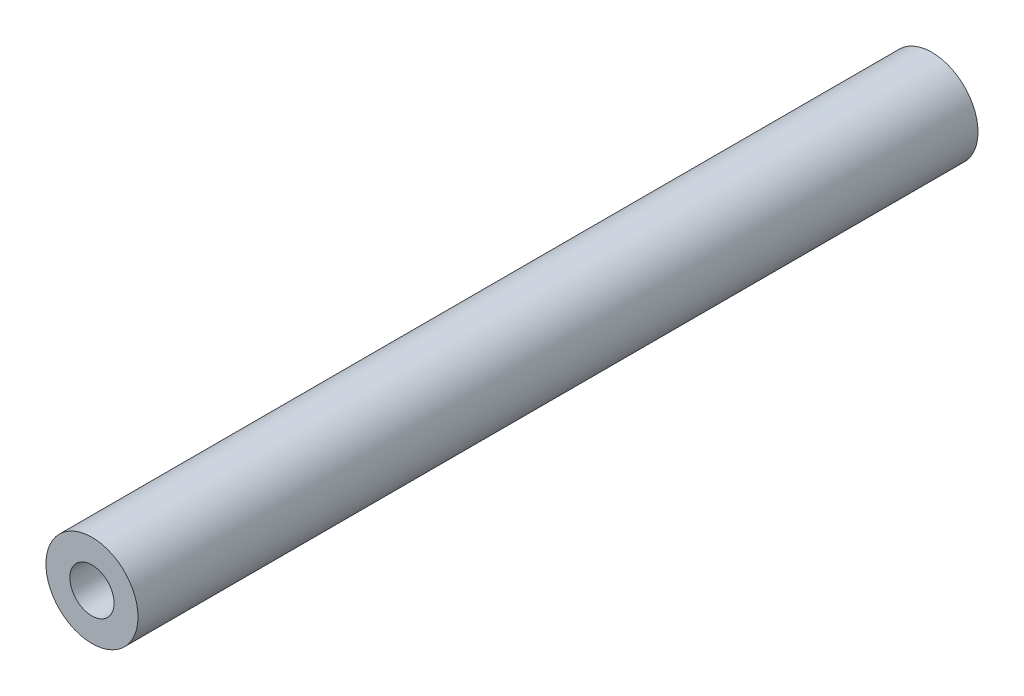
from build123d import *

# Parameters (mm, degrees)
SKETCH1_R           = 3.175
SKETCH1_R_2         = 1.524
BOSS_EXTRUDE1_DEPTH = 57.912


with BuildPart() as part:
    # Sketch1 → Boss-Extrude1 (new body)
    with BuildSketch(Plane.XY):
        Circle(SKETCH1_R)
        Circle(SKETCH1_R_2, mode=Mode.SUBTRACT)
    extrude(amount=BOSS_EXTRUDE1_DEPTH)


solid = part.part
